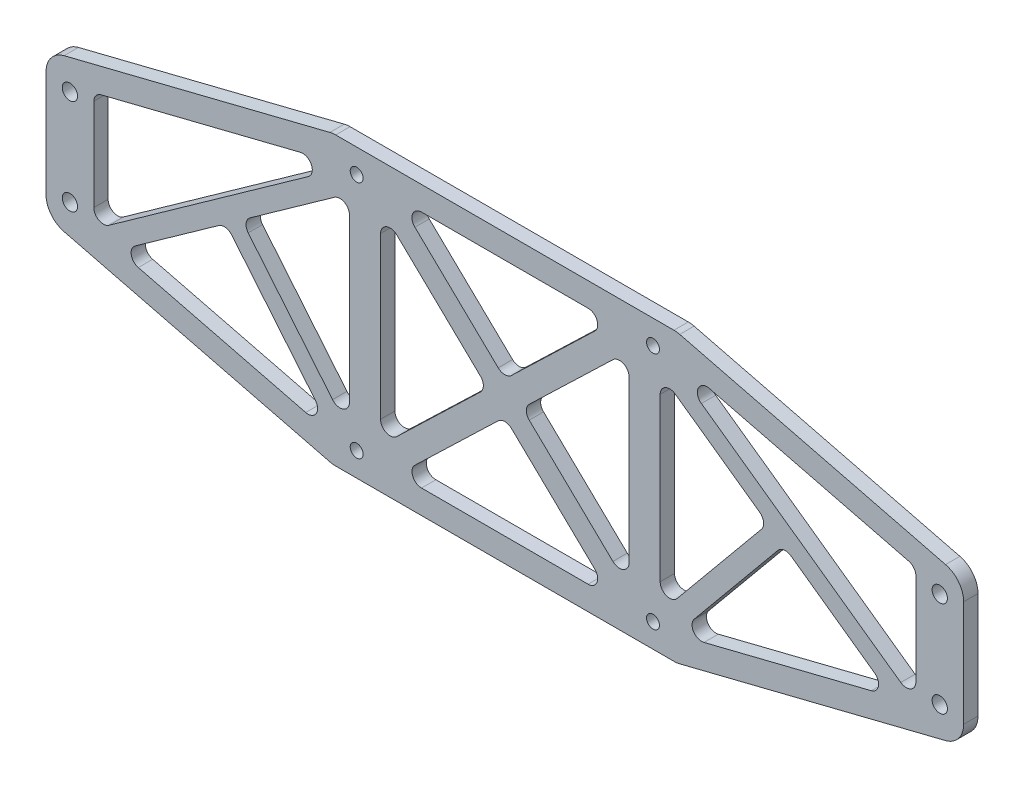
from build123d import *

# Parameters (mm, degrees)
SKETCH_1_W          = 202
SKETCH_1_H          = 60
SKETCH_1_R          = 1.35
EXTRUDE_1_DEPTH     = 3
SKETCH_2_R          = 1.6
CUT_EXTRUDE_1_DEPTH = 10
SKETCH_3_OUTSIDE_W  = 246.148
SKETCH_3_OUTSIDE_H  = 104.148
CUT_EXTRUDE_2_DEPTH = 10
CUT_EXTRUDE_3_DEPTH = 10
CUT_EXTRUDE_4_DEPTH = 10
FILLET_1_R          = 2
FILLET_2_R          = 5


with BuildPart() as part:
    # 草图1 → 凸台-拉伸1 (new body)
    with BuildSketch(Plane.XY):
        Rectangle(SKETCH_1_W, SKETCH_1_H)
        with Locations((31, 25)):
            Circle(SKETCH_1_R, mode=Mode.SUBTRACT)
        with Locations((-31, 25)):
            Circle(SKETCH_1_R, mode=Mode.SUBTRACT)
        with Locations((-31, -25)):
            Circle(SKETCH_1_R, mode=Mode.SUBTRACT)
        with Locations((31, -25)):
            Circle(SKETCH_1_R, mode=Mode.SUBTRACT)
    extrude(amount=EXTRUDE_1_DEPTH)

    # 草图2 → 切除-拉伸1 (cut)
    with BuildSketch(Plane.XY.offset(3)):
        with Locations((91, -10)):
            Circle(SKETCH_2_R)
        with Locations((91, 10)):
            Circle(SKETCH_2_R)
    cut_extrude_1 = extrude(amount=-CUT_EXTRUDE_1_DEPTH, mode=Mode.SUBTRACT)

    # 镜向1: 切除-拉伸1 across plane
    add(cut_extrude_1.mirror(Plane(origin=(0, 0, 0), x_dir=(0, 0, 1), z_dir=(1, 0, 0))), mode=Mode.SUBTRACT)

    # 草图3 outside → 切除-拉伸2 (cut)
    with BuildSketch(Plane.XY.offset(3)):
        Rectangle(SKETCH_3_OUTSIDE_W, SKETCH_3_OUTSIDE_H)
        Polygon((-96, 15), (-96, -15), (-36, -30), (36, -30), (96, -15), (96, 15), (36, 30), (-36, 30), align=None, mode=Mode.SUBTRACT)
    extrude(amount=-CUT_EXTRUDE_2_DEPTH, mode=Mode.SUBTRACT)

    # 草图4 → 切除-拉伸3 (cut)
    with BuildSketch(Plane.XY.offset(3)):
        Polygon((-32.5, 25.721117968), (-86, 12.346117968), (-86, -12.346117968), (-57.616230147, 7.849987896), align=None)
        Polygon((-58.330965527, 2.432194903), (-80.89439135, -13.622520131), (-35.767539705, -24.904233042), align=None)
        Polygon((-32.5, -22.579257249), (-32.5, 20.811885729), (-55.063425822, 4.757170695), align=None)
    cut_extrude_3 = extrude(amount=-CUT_EXTRUDE_3_DEPTH, mode=Mode.SUBTRACT)

    # 镜向2: 切除-拉伸3 across plane
    add(cut_extrude_3.mirror(Plane(origin=(0, 0, 0), x_dir=(0, 0, 1), z_dir=(1, 0, 0))), mode=Mode.SUBTRACT)

    # 草图6 → 切除-拉伸4 (cut)
    with BuildSketch(Plane.XY.offset(3)):
        Polygon((-26, 21.531790616), (-26, -21.531790616), (-3.606937759, 0), align=None)
        Polygon((-22.393062241, 25), (0, 3.468209384), (22.393062241, 25), align=None)
        Polygon((26, 21.531790616), (3.606937759, 0), (26, -21.531790616), align=None)
        Polygon((0, -3.468209384), (-22.393062241, -25), (22.393062241, -25), align=None)
    extrude(amount=-CUT_EXTRUDE_4_DEPTH, mode=Mode.SUBTRACT)

    # 圆角1
    fillet_1_edges = [part.edges().sort_by_distance(p)[0] for p in [
        (-55.063425822, 4.757170695, 1.5),
        (-32.5, 20.811885729, 1.5),
        (-32.5, -22.579257249, 1.5),
        (-58.330965527, 2.432194903, 1.5),
        (-35.767539705, -24.904233042, 1.5),
        (-80.89439135, -13.622520131, 1.5),
        (-32.5, 25.721117968, 1.5),
        (-86, -12.346117968, 1.5),
        (-86, 12.346117968, 1.5),
        (32.5, 20.811885729, 1.5),
        (55.063425822, 4.757170695, 1.5),
        (32.5, -22.579257249, 1.5),
        (35.767539705, -24.904233042, 1.5),
        (58.330965527, 2.432194903, 1.5),
        (80.89439135, -13.622520131, 1.5),
        (86, -12.346117968, 1.5),
        (32.5, 25.721117968, 1.5),
        (86, 12.346117968, 1.5),
        (3.606937759, 0, 1.5),
        (26, 21.531790616, 1.5),
        (26, -21.531790616, 1.5),
        (0, 3.468209384, 1.5),
        (-22.393062241, 25, 1.5),
        (22.393062241, 25, 1.5),
        (-22.393062241, -25, 1.5),
        (0, -3.468209384, 1.5),
        (22.393062241, -25, 1.5),
        (-26, -21.531790616, 1.5),
        (-26, 21.531790616, 1.5),
        (-3.606937759, 0, 1.5),
    ]]
    fillet(fillet_1_edges, radius=FILLET_1_R)

    # 圆角2
    fillet_2_edges = [part.edges().sort_by_distance(p)[0] for p in [
        (-36, -30, 1.5),
        (36, -30, 1.5),
        (36, 30, 1.5),
        (-36, 30, 1.5),
        (96, 15, 1.5),
        (96, -15, 1.5),
        (-96, -15, 1.5),
        (-96, 15, 1.5),
    ]]
    fillet(fillet_2_edges, radius=FILLET_2_R)


solid = part.part
